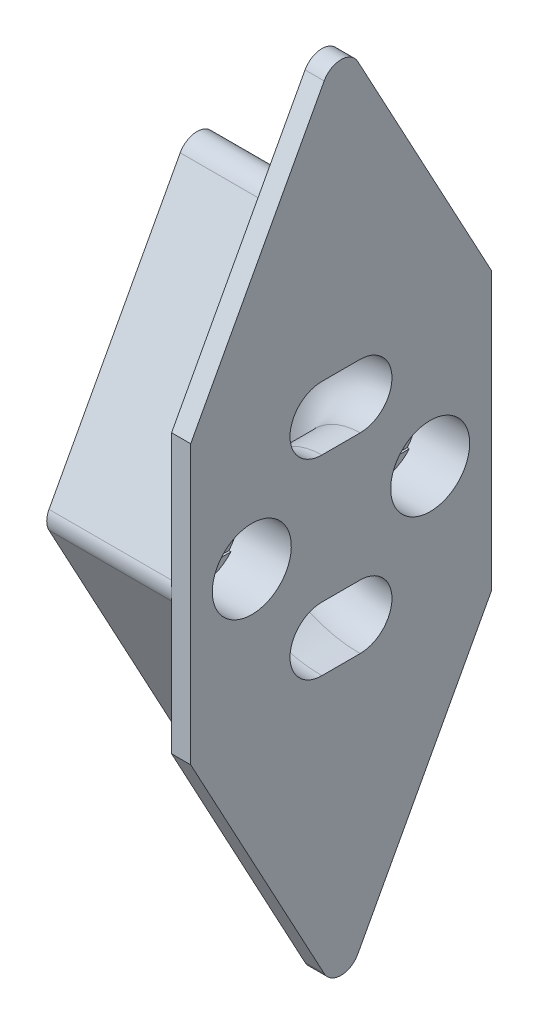
from build123d import *
from build123d.topology import SkipClean

# Parameters (mm, degrees)
BOSS_EXTRUDE1_DEPTH = 12.446
BOSS_EXTRUDE3_DEPTH = 1.905
FILLET1_R           = 1.905
SKETCH8_R           = 3.937
CUT_EXTRUDE3_DEPTH  = 5.08
SKETCH9_R           = 2.5527
CUT_EXTRUDE4_DEPTH  = 47.270145624
CUT_EXTRUDE7_DEPTH  = 48.009337913
CUT_EXTRUDE8_DEPTH  = 0.2
SKETCH14_W          = 5.1054
SKETCH14_H          = 5.1054
CUT_EXTRUDE9_DEPTH  = 0.2


with BuildPart() as part:
    # Sketch1 → Boss-Extrude1 (new body)
    with BuildSketch(Plane(origin=(0, 0, 0), x_dir=(0, 0, -1), z_dir=(1, 0, 0))):
        Polygon((0, -28.2575), (15.24, 0), (0, 28.2575), (-15.24, 0), align=None)
    extrude(amount=BOSS_EXTRUDE1_DEPTH)

    # Sketch6 → Boss-Extrude3 (add)
    with BuildSketch(Plane(origin=(12.446, 0, 0), x_dir=(0, 0, -1), z_dir=(1, 0, 0))):
        Polygon((-22.454651823, 0), (0, -41.634666921), (22.454651823, 0), (0, 41.634666921), align=None)
    extrude(amount=BOSS_EXTRUDE3_DEPTH)

    # Fillet1
    fillet1_edges = [part.edges().sort_by_distance(p)[0] for p in [
        (13.3985, 41.634666921, 0),
        (13.3985, 0, 22.454651823),
        (13.3985, -41.634666921, 0),
        (13.3985, 0, -22.454651823),
        (6.223, 0, -15.24),
        (6.223, -28.2575, 0),
        (6.223, 0, 15.24),
        (6.223, 28.2575, 0),
    ]]
    fillet(fillet1_edges, radius=FILLET1_R)

    # Sketch7 → Cut-Revolve2 (revolve, cut)
    with BuildSketch(Plane(origin=(0, 0, 0), x_dir=(1, 0, 0), z_dir=(0, 1, 0))):
        with BuildLine():
            Line((1.651, -1.905), (1.651, 1.905))
            ThreePointArc((1.651, 1.905), (4.826, 5.08), (8.001, 1.905))
            Line((8.001, 1.905), (8.001, -1.905))
            ThreePointArc((8.001, -1.905), (4.826, -5.08), (1.651, -1.905))
        make_face()
    revolve(axis=Axis((14.351, 0, 0), (0, 0, 1)), mode=Mode.SUBTRACT)

    # Sketch8 → Cut-Extrude3 (cut)
    with BuildSketch(Plane(origin=(14.351, 0, 0), x_dir=(0, 0, -1), z_dir=(1, 0, 0))):
        with Locations((8.89, 0)):
            Circle(SKETCH8_R)
        with Locations(Location((-8.89, 0, 0), (0, 0, 180))):
            Circle(SKETCH8_R)
    extrude(amount=-CUT_EXTRUDE3_DEPTH, mode=Mode.SUBTRACT)

    # Sketch9 → Cut-Extrude4 (cut, through all)
    with BuildSketch(Plane(origin=(9.271, 0, 0), x_dir=(0, 0, -1), z_dir=(1, 0, 0))):
        with Locations((8.89, 0)):
            Circle(SKETCH9_R)
        with Locations(Location((-8.89, 0, 0), (0, 0, 180))):
            Circle(SKETCH9_R)
    extrude(amount=-CUT_EXTRUDE4_DEPTH, mode=Mode.SUBTRACT)

    # Sketch12 → Cut-Extrude7 (cut, through all)
    with BuildSketch(Plane.ZY.offset(-12.446)):
        with BuildLine():
            Line((-14.980604453, -13.858129497), (-14.980604453, 13.858129497))
            Line((-14.980604453, 13.858129497), (-21.966948415, 0.904283401))
            ThreePointArc((-21.966948415, 0.904283401), (-22.195256276, 0), (-21.966948415, -0.904283401))
            Line((-21.966948415, -0.904283401), (-14.980604453, -13.858129497))
        make_face()
        with BuildLine():
            Line((14.980604453, -13.858129497), (14.980604453, 13.858129497))
            Line((14.980604453, 13.858129497), (21.966948415, 0.904283401))
            ThreePointArc((21.966948415, 0.904283401), (22.195256276, 0), (21.966948415, -0.904283401))
            Line((21.966948415, -0.904283401), (14.980604453, -13.858129497))
        make_face()
    extrude(amount=-CUT_EXTRUDE7_DEPTH, mode=Mode.SUBTRACT)

    # Sketch13 → Cut-Extrude8 (cut)
    with SkipClean():  # the faces are left unmerged after this step: merging them gives an invalid solid
        with BuildSketch(Plane(origin=(9.271, 0, 0), x_dir=(0, 0, -1), z_dir=(1, 0, 0))):
            with BuildLine():
                Line((5.892719281, 2.5527), (11.887280719, 2.5527))
                ThreePointArc((11.887280719, 2.5527), (12.827, 0), (11.887280719, -2.5527))
                Line((11.887280719, -2.5527), (5.892719281, -2.5527))
                ThreePointArc((5.892719281, -2.5527), (4.953, 0), (5.892719281, 2.5527))
            make_face()
            with BuildLine():
                Line((-11.887280719, 2.5527), (-5.892719281, 2.5527))
                ThreePointArc((-5.892719281, 2.5527), (-4.953, 0), (-5.892719281, -2.5527))
                Line((-5.892719281, -2.5527), (-11.887280719, -2.5527))
                ThreePointArc((-11.887280719, -2.5527), (-12.827, 0), (-11.887280719, 2.5527))
            make_face()
        extrude(amount=-CUT_EXTRUDE8_DEPTH, mode=Mode.SUBTRACT)

    # Sketch14 → Cut-Extrude9 (cut)
    with SkipClean():  # the faces are left unmerged after this step: merging them gives an invalid solid
        with BuildSketch(Plane(origin=(9.071, 0, 0), x_dir=(0, 0, -1), z_dir=(1, 0, 0))):
            with Locations((8.89, 0)):
                Rectangle(SKETCH14_W, SKETCH14_H)
            with Locations((-8.89, 0)):
                Rectangle(SKETCH14_W, SKETCH14_H)
        extrude(amount=-CUT_EXTRUDE9_DEPTH, mode=Mode.SUBTRACT)


solid = part.part
